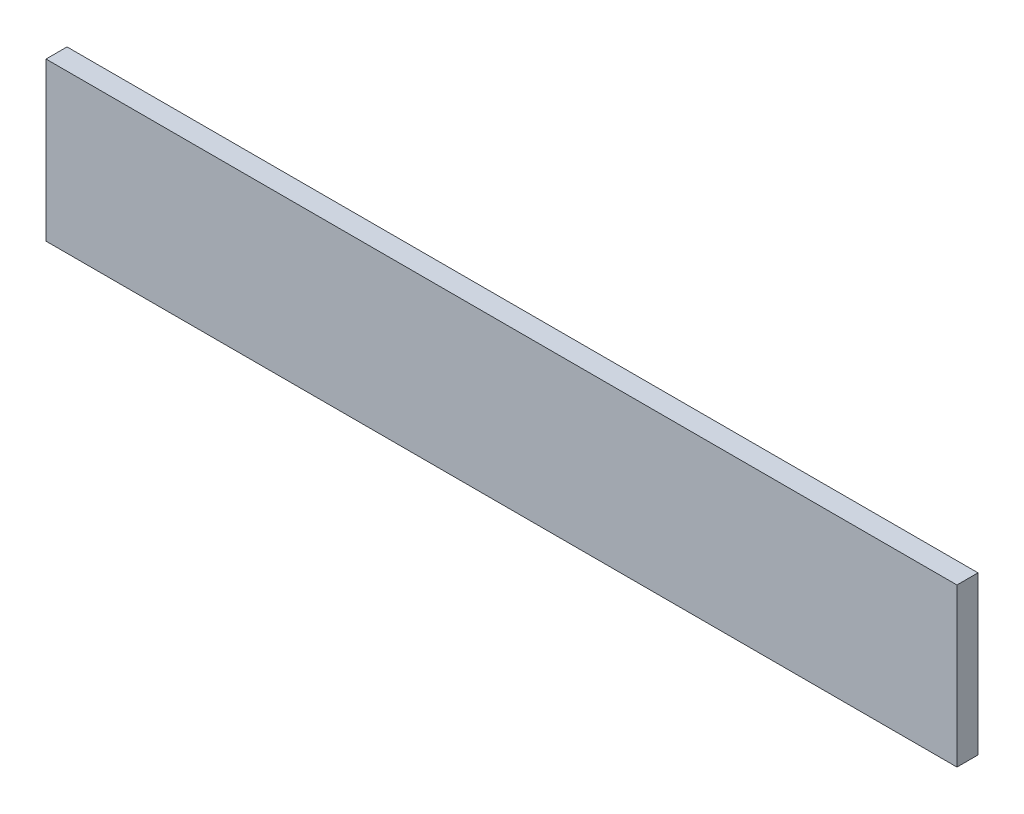
from build123d import *

# Parameters (mm, degrees)
SKETCH_1_W      = 693
SKETCH_1_H      = 120
EXTRUDE_1_DEPTH = 16


with BuildPart() as part:
    # 草图1 → 凸台-拉伸1 (new body)
    with BuildSketch(Plane.XY):
        Rectangle(SKETCH_1_W, SKETCH_1_H)
    extrude(amount=EXTRUDE_1_DEPTH)


solid = part.part
